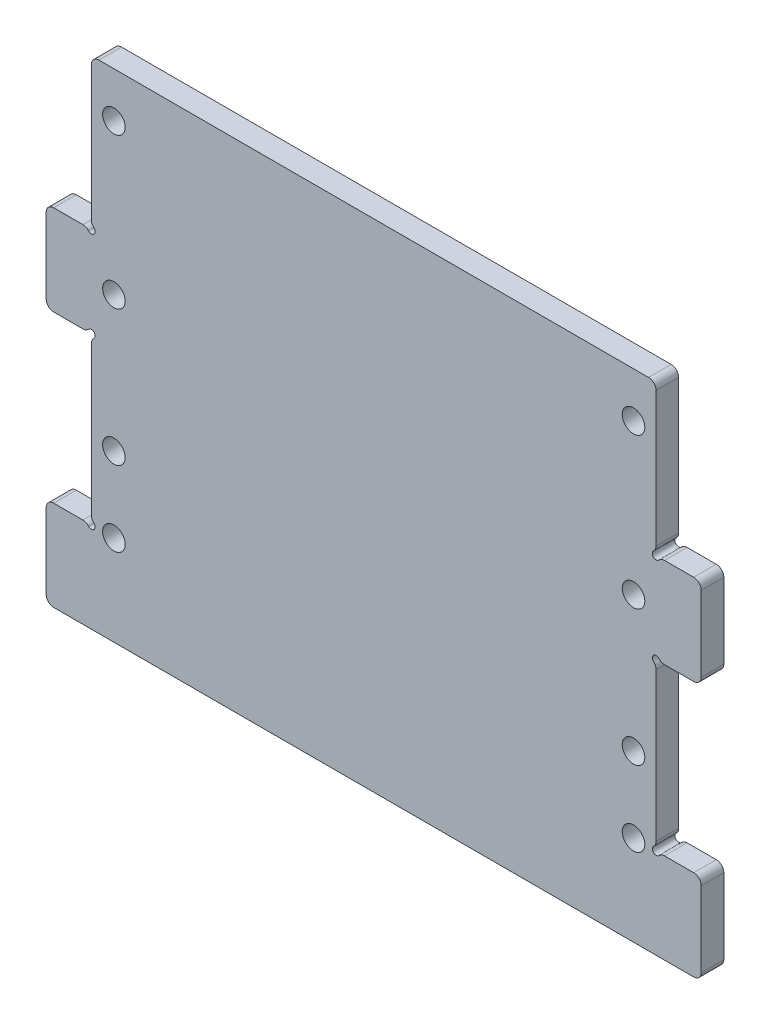
from build123d import *

# Parameters (mm, degrees)
SKETCH_1_R      = 1.5
EXTRUDE_1_DEPTH = 3
FILLET_1_R      = 1


with BuildPart() as part:
    # 草图1 → 凸台-拉伸1 (new body)
    with BuildSketch(Plane.XY):
        with BuildLine():
            ThreePointArc((-38.025, -15), (-37.171446609, -15.353553391), (-37.525, -14.5))
            Line((-37.525, -14.5), (-37.525, 6.5))
            ThreePointArc((-37.525, 6.5), (-37.171446609, 7.353553391), (-38.025, 7))
            Line((-38.025, 7), (-43.525, 7))
            Line((-43.525, 7), (-43.525, 19))
            Line((-43.525, 19), (-38.025, 19))
            ThreePointArc((-38.025, 19), (-37.171446609, 18.646446609), (-37.525, 19.5))
            Line((-37.525, 19.5), (-37.525, 39))
            Line((-37.525, 39), (37.525, 39))
            Line((37.525, 39), (37.525, 19.5))
            ThreePointArc((37.525, 19.5), (37.171446609, 18.646446609), (38.025, 19))
            Line((38.025, 19), (43.525, 19))
            Line((43.525, 19), (43.525, 7))
            Line((43.525, 7), (38.025, 7))
            ThreePointArc((38.025, 7), (37.171446609, 7.353553391), (37.525, 6.5))
            Line((37.525, 6.5), (37.525, -14.5))
            ThreePointArc((37.525, -14.5), (37.171446609, -15.353553391), (38.025, -15))
            Line((38.025, -15), (43.525, -15))
            Line((43.525, -15), (43.525, -27))
            Line((43.525, -27), (37.525, -27))
            Line((37.525, -27), (-37.525, -27))
            Line((-37.525, -27), (-43.525, -27))
            Line((-43.525, -27), (-43.525, -15))
            Line((-43.525, -15), (-38.025, -15))
        make_face()
        with Locations((34.525, -5)):
            Circle(SKETCH_1_R, mode=Mode.SUBTRACT)
        with Locations((34.525, 33)):
            Circle(SKETCH_1_R, mode=Mode.SUBTRACT)
        with Locations((-34.525, -15)):
            Circle(SKETCH_1_R, mode=Mode.SUBTRACT)
        with Locations((-34.525, -5)):
            Circle(SKETCH_1_R, mode=Mode.SUBTRACT)
        with Locations((-34.525, 13)):
            Circle(SKETCH_1_R, mode=Mode.SUBTRACT)
        with Locations((-34.525, 33)):
            Circle(SKETCH_1_R, mode=Mode.SUBTRACT)
        with Locations((34.525, 13)):
            Circle(SKETCH_1_R, mode=Mode.SUBTRACT)
        with Locations((34.525, -15)):
            Circle(SKETCH_1_R, mode=Mode.SUBTRACT)
    extrude(amount=EXTRUDE_1_DEPTH)

    # 圆角1
    fillet_1_edges = [part.edges().sort_by_distance(p)[0] for p in [
        (-37.525, -14.5, 1.5),
        (-37.525, 6.5, 1.5),
        (-38.025, 7, 1.5),
        (-43.525, 7, 1.5),
        (-43.525, 19, 1.5),
        (-38.025, 19, 1.5),
        (-37.525, 19.5, 1.5),
        (-37.525, 39, 1.5),
        (37.525, 39, 1.5),
        (37.525, 19.5, 1.5),
        (38.025, 19, 1.5),
        (43.525, 19, 1.5),
        (43.525, 7, 1.5),
        (38.025, 7, 1.5),
        (37.525, 6.5, 1.5),
        (37.525, -14.5, 1.5),
        (38.025, -15, 1.5),
        (43.525, -15, 1.5),
        (43.525, -27, 1.5),
        (-43.525, -27, 1.5),
        (-43.525, -15, 1.5),
        (-38.025, -15, 1.5),
    ]]
    fillet(fillet_1_edges, radius=FILLET_1_R)


solid = part.part
